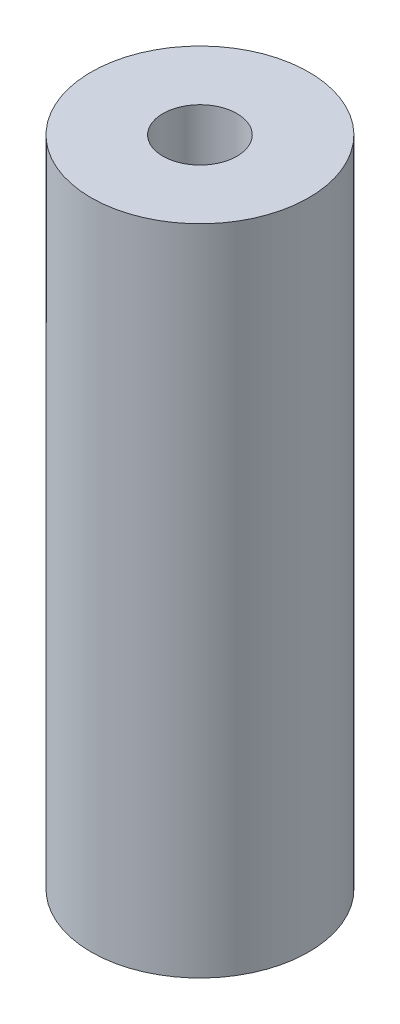
from build123d import *

# Parameters (mm, degrees)
SKETCH_1_R          = 1.25
EXTRUDE_1_DEPTH     = 2
SKETCH_2_R          = 2.5
EXTRUDE_2_DEPTH     = 15
SKETCH_3_R          = 0.85
CUT_EXTRUDE_1_DEPTH = 8
SKETCH_1_3_R        = 1.25
CUT_EXTRUDE_2_DEPTH = 10


with BuildPart() as part:
    # 草图1 → 凸台-拉伸1 (new body)
    with BuildSketch(Plane(origin=(0, 0, 0), x_dir=(1, 0, 0), z_dir=(0, 1, 0))):
        Circle(SKETCH_1_R)
    extrude(amount=EXTRUDE_1_DEPTH)

    # 草图2 → 凸台-拉伸2 (add)
    with BuildSketch(Plane(origin=(0, 2, 0), x_dir=(1, 0, 0), z_dir=(0, 1, 0))):
        Circle(SKETCH_2_R)
    extrude(amount=EXTRUDE_2_DEPTH)

    # 草图3 → 切除-拉伸1 (cut)
    with BuildSketch(Plane(origin=(0, 17, 0), x_dir=(1, 0, 0), z_dir=(0, 1, 0))):
        Circle(SKETCH_3_R)
    extrude(amount=-CUT_EXTRUDE_1_DEPTH, mode=Mode.SUBTRACT)

    # 草图1<3> → 切除-拉伸2 (cut)
    with BuildSketch(Plane(origin=(0, 0, 0), x_dir=(1, 0, 0), z_dir=(0, 1, 0))):
        Circle(SKETCH_1_3_R)
    extrude(amount=CUT_EXTRUDE_2_DEPTH, mode=Mode.SUBTRACT)


solid = part.part
